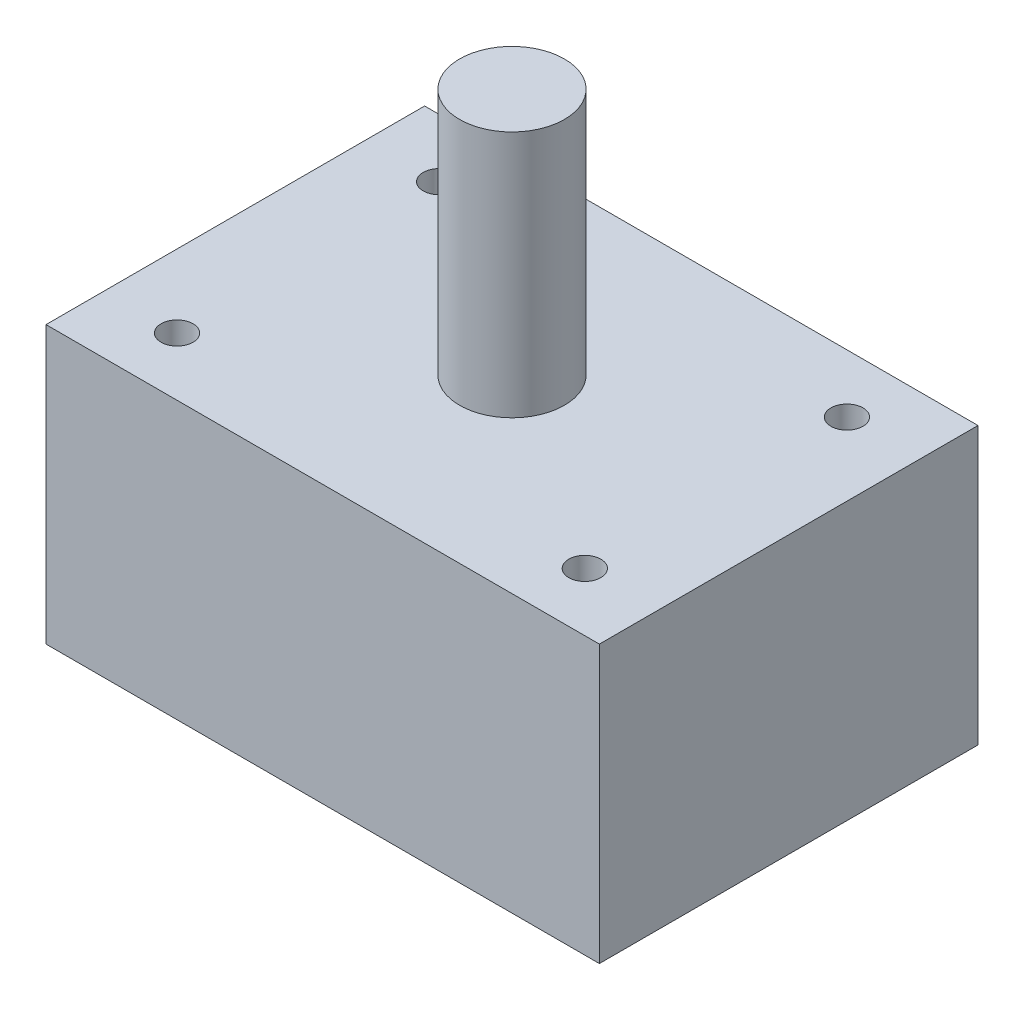
from build123d import *

# Parameters (mm, degrees)
F_01_HOUSING_PROFILE_W      = 190
F_01_HOUSING_PROFILE_H      = 130
F_01_HOUSING_PROFILE_R      = 5.5
F_01_HOUSING_BLOCK_DEPTH    = 95
F_03_OUTPUT_SHAFT_PROFILE_R = 18
F_03_OUTPUT_SHAFT_DEPTH     = 180


with BuildPart() as part:
    # 01_Housing_Profile → 01_Housing_Block (new body)
    with BuildSketch(Plane(origin=(0, 0, 0), x_dir=(1, 0, 0), z_dir=(0, 1, 0))):
        Rectangle(F_01_HOUSING_PROFILE_W, F_01_HOUSING_PROFILE_H)
        with Locations(Location((-70, -45, 0), (0, 0, 270))):
            Circle(F_01_HOUSING_PROFILE_R, mode=Mode.SUBTRACT)
        with Locations(Location((70, -45, 0), (0, 0, 270))):
            Circle(F_01_HOUSING_PROFILE_R, mode=Mode.SUBTRACT)
        with Locations(Location((-70, 45, 0), (0, 0, 270))):
            Circle(F_01_HOUSING_PROFILE_R, mode=Mode.SUBTRACT)
        with Locations(Location((70, 45, 0), (0, 0, 270))):
            Circle(F_01_HOUSING_PROFILE_R, mode=Mode.SUBTRACT)
    extrude(amount=F_01_HOUSING_BLOCK_DEPTH)

    # 03_Output_Shaft_Profile → 03_Output_Shaft (add)
    with BuildSketch(Plane(origin=(0, 0, 0), x_dir=(1, 0, 0), z_dir=(0, 1, 0))):
        with Locations(Location((0, 0, 0), (0, 0, 90))):
            Circle(F_03_OUTPUT_SHAFT_PROFILE_R)
    extrude(amount=F_03_OUTPUT_SHAFT_DEPTH)


solid = part.part
